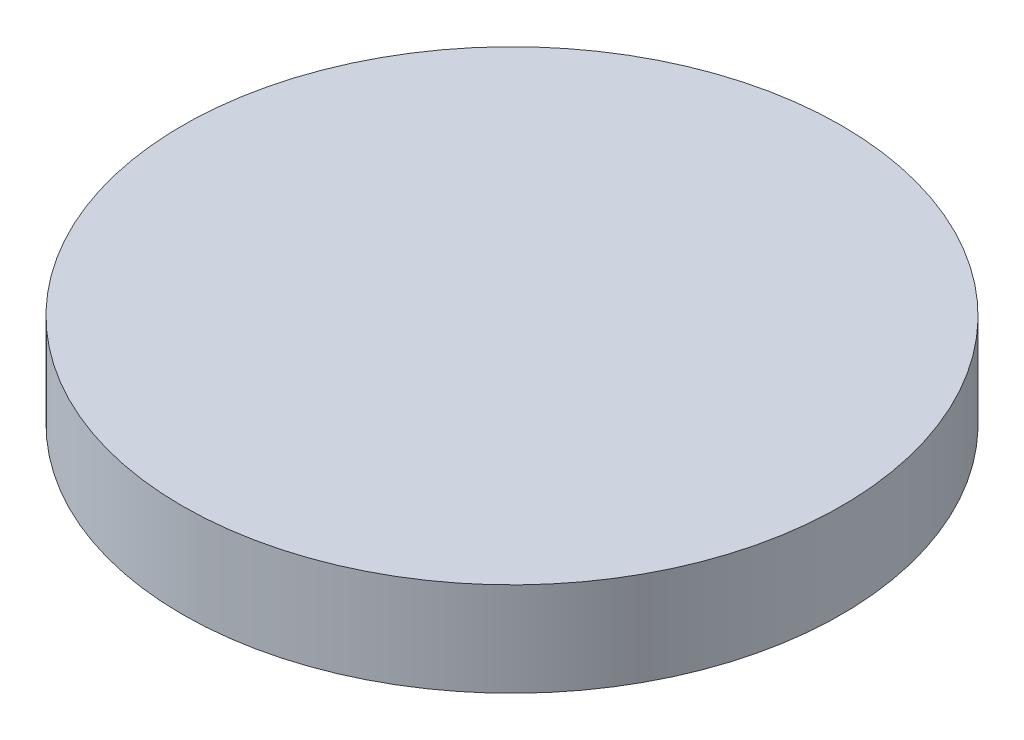
from build123d import *

# Parameters (mm, degrees)
SKETCH1_R           = 35.104239728
BOSS_EXTRUDE1_DEPTH = 10


with BuildPart() as part:
    # Sketch1 → Boss-Extrude1 (new body)
    with BuildSketch(Plane(origin=(0, 0, 0), x_dir=(1, 0, 0), z_dir=(0, 1, 0))):
        with Locations(Location((0, 0, 0), (0, 0, 270))):
            Circle(SKETCH1_R)
    extrude(amount=BOSS_EXTRUDE1_DEPTH)


solid = part.part
